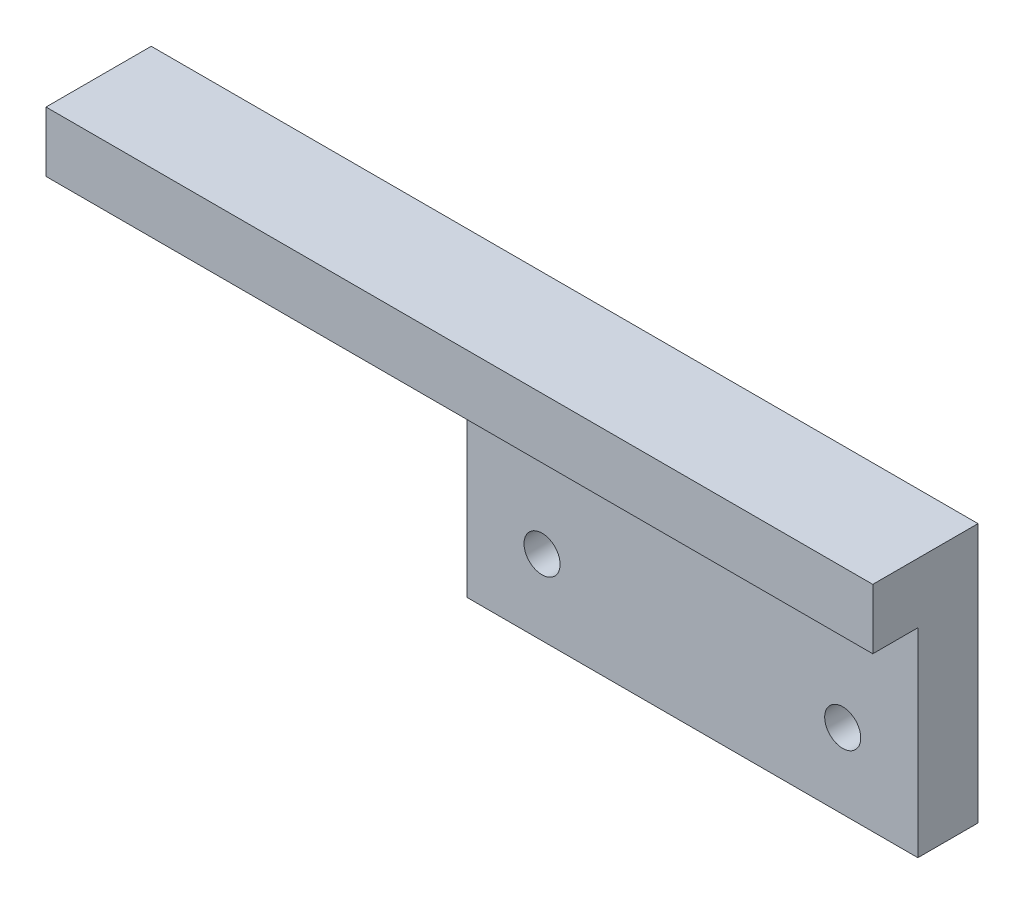
from build123d import *

# Parameters (mm, degrees)
SKETCH_1_W                   = 60
SKETCH_1_H                   = 26.5
EXTRUDE_1_DEPTH              = 8
EXTRUDE_2_DEPTH              = 6
EXTRUDE_2_DEPTH_BACK         = 8
SKETCH_2_W                   = 60
SKETCH_2_H                   = 8
HOLE_WIZARD_M4_1_D           = 4.8
HOLE_WIZARD_M4_1_DEPTH       = 10.1
HOLE_WIZARD_M4_1_CBORE_D     = 8
HOLE_WIZARD_M4_1_CBORE_DEPTH = 4
HOLE_WIZARD_M4_1_TIP         = 1.442065486
SKETCH_7_W                   = 14
SKETCH_7_H                   = 8
EXTRUDE_3_DEPTH              = 50


with BuildPart() as part:
    # 스케치1 → 보스-돌출1 (new body)
    with BuildSketch(Plane.XY):
        Rectangle(SKETCH_1_W, SKETCH_1_H)
    extrude(amount=EXTRUDE_1_DEPTH)

    # 스케치2 → 보스-돌출2 (add, two sides: drawn at the far end of the back side and taken through both)
    with BuildSketch(Plane.XY.offset(8).offset(-EXTRUDE_2_DEPTH_BACK)):
        with Locations((0, 17.25)):
            Rectangle(SKETCH_2_W, SKETCH_2_H)
    extrude(amount=EXTRUDE_2_DEPTH + EXTRUDE_2_DEPTH_BACK)

    # M4 소켓 머리 캡 나사용 카운터보어1
    with Locations(Plane(origin=(0, 0, 0), x_dir=(-1, 0, 0), z_dir=(0, 0, -1))):
        with Locations((-20, -3.25), (20, -3.25)):
            CounterBoreHole(HOLE_WIZARD_M4_1_D / 2, HOLE_WIZARD_M4_1_CBORE_D / 2, HOLE_WIZARD_M4_1_CBORE_DEPTH, depth=HOLE_WIZARD_M4_1_DEPTH)
            with Locations((0, 0, -(HOLE_WIZARD_M4_1_DEPTH + HOLE_WIZARD_M4_1_TIP / 2))):  # 118° drill point
                Cone(0, HOLE_WIZARD_M4_1_D / 2, HOLE_WIZARD_M4_1_TIP, mode=Mode.SUBTRACT)

    # 스케치7 → 보스-돌출3 (add)
    with BuildSketch(Plane.ZY.offset(30)):
        with Locations((7, 17.25)):
            Rectangle(SKETCH_7_W, SKETCH_7_H)
    extrude(amount=EXTRUDE_3_DEPTH)


solid = part.part
